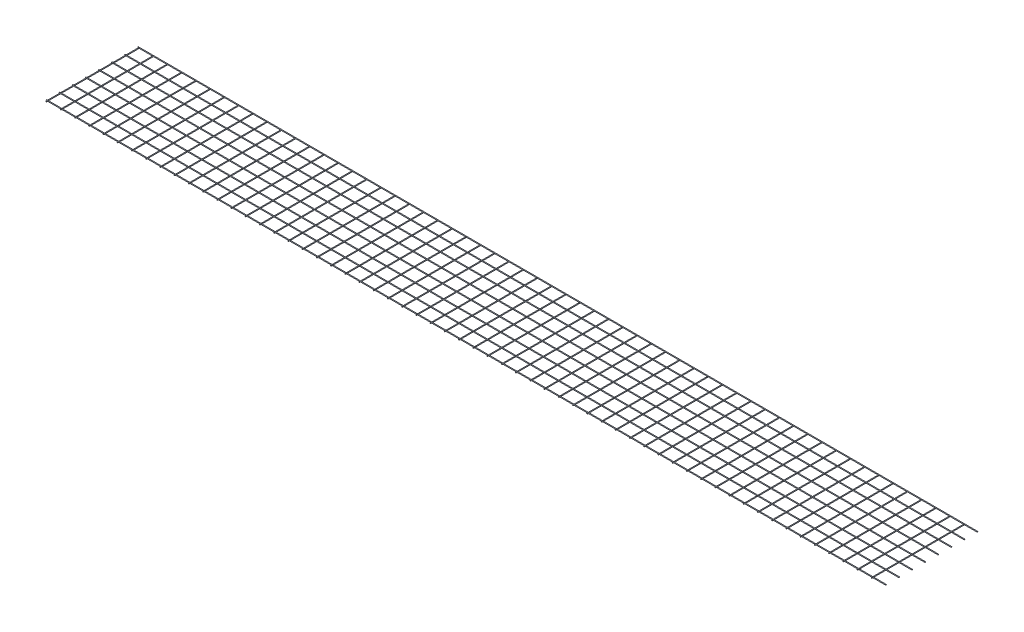
from build123d import *

# Parameters (mm, degrees)
SKETCH1_R              = 2.5
BOSS_EXTRUDE1_DEPTH    = 650
BOSS_EXTRUDE1_2_DEPTH  = 650
BOSS_EXTRUDE1_3_DEPTH  = 650
BOSS_EXTRUDE1_4_DEPTH  = 650
BOSS_EXTRUDE1_5_DEPTH  = 650
BOSS_EXTRUDE1_6_DEPTH  = 650
BOSS_EXTRUDE1_7_DEPTH  = 650
BOSS_EXTRUDE1_8_DEPTH  = 650
BOSS_EXTRUDE1_9_DEPTH  = 650
BOSS_EXTRUDE1_10_DEPTH = 650
BOSS_EXTRUDE1_11_DEPTH = 650
BOSS_EXTRUDE1_12_DEPTH = 650
BOSS_EXTRUDE1_13_DEPTH = 650
BOSS_EXTRUDE1_14_DEPTH = 650
BOSS_EXTRUDE1_15_DEPTH = 650
BOSS_EXTRUDE1_16_DEPTH = 650
BOSS_EXTRUDE1_17_DEPTH = 650
BOSS_EXTRUDE1_18_DEPTH = 650
BOSS_EXTRUDE1_19_DEPTH = 650
BOSS_EXTRUDE1_20_DEPTH = 650
BOSS_EXTRUDE1_21_DEPTH = 650
BOSS_EXTRUDE1_22_DEPTH = 650
BOSS_EXTRUDE1_23_DEPTH = 650
BOSS_EXTRUDE1_24_DEPTH = 650
BOSS_EXTRUDE1_25_DEPTH = 650
BOSS_EXTRUDE1_26_DEPTH = 650
BOSS_EXTRUDE1_27_DEPTH = 650
BOSS_EXTRUDE1_28_DEPTH = 650
BOSS_EXTRUDE1_29_DEPTH = 650
BOSS_EXTRUDE1_30_DEPTH = 650
BOSS_EXTRUDE1_31_DEPTH = 650
BOSS_EXTRUDE1_32_DEPTH = 650
BOSS_EXTRUDE1_33_DEPTH = 650
BOSS_EXTRUDE1_34_DEPTH = 650
BOSS_EXTRUDE1_35_DEPTH = 650
BOSS_EXTRUDE1_36_DEPTH = 650
BOSS_EXTRUDE1_37_DEPTH = 650
BOSS_EXTRUDE1_38_DEPTH = 650
BOSS_EXTRUDE1_39_DEPTH = 650
BOSS_EXTRUDE1_40_DEPTH = 650
BOSS_EXTRUDE1_41_DEPTH = 650
BOSS_EXTRUDE1_42_DEPTH = 650
BOSS_EXTRUDE1_43_DEPTH = 650
BOSS_EXTRUDE1_44_DEPTH = 650
BOSS_EXTRUDE1_45_DEPTH = 650
BOSS_EXTRUDE1_46_DEPTH = 650
BOSS_EXTRUDE1_47_DEPTH = 650
BOSS_EXTRUDE1_48_DEPTH = 650
BOSS_EXTRUDE1_49_DEPTH = 650
BOSS_EXTRUDE1_50_DEPTH = 650
BOSS_EXTRUDE1_51_DEPTH = 650
BOSS_EXTRUDE1_52_DEPTH = 650
BOSS_EXTRUDE1_53_DEPTH = 650
BOSS_EXTRUDE1_54_DEPTH = 650
BOSS_EXTRUDE1_55_DEPTH = 650
BOSS_EXTRUDE1_56_DEPTH = 650
BOSS_EXTRUDE1_57_DEPTH = 650
BOSS_EXTRUDE1_58_DEPTH = 650
BOSS_EXTRUDE1_59_DEPTH = 650
SKETCH2_R              = 2.5
BOSS_EXTRUDE2_DEPTH    = 5900
BOSS_EXTRUDE2_2_DEPTH  = 5900
BOSS_EXTRUDE2_3_DEPTH  = 5900
BOSS_EXTRUDE2_4_DEPTH  = 5900
BOSS_EXTRUDE2_5_DEPTH  = 5900
BOSS_EXTRUDE2_6_DEPTH  = 5900
BOSS_EXTRUDE2_7_DEPTH  = 5900
BOSS_EXTRUDE2_8_DEPTH  = 5900


with BuildPart() as part:
    # Sketch1 → Boss-Extrude1 (new body)
    with BuildSketch(Plane.XY):
        with Locations((-80.079456232, 0)):
            Circle(SKETCH1_R)
    extrude(amount=BOSS_EXTRUDE1_DEPTH)


with BuildPart() as body_2:
    # Sketch1 → Boss-Extrude1 2 (new body)
    with BuildSketch(Plane.XY):
        with Locations((19.920543768, 0)):
            Circle(SKETCH1_R)
    extrude(amount=BOSS_EXTRUDE1_2_DEPTH)


with BuildPart() as body_3:
    # Sketch1 → Boss-Extrude1 3 (new body)
    with BuildSketch(Plane.XY):
        with Locations((119.920543768, 0)):
            Circle(SKETCH1_R)
    extrude(amount=BOSS_EXTRUDE1_3_DEPTH)


with BuildPart() as body_4:
    # Sketch1 → Boss-Extrude1 4 (new body)
    with BuildSketch(Plane.XY):
        with Locations((219.920543768, 0)):
            Circle(SKETCH1_R)
    extrude(amount=BOSS_EXTRUDE1_4_DEPTH)


with BuildPart() as body_5:
    # Sketch1 → Boss-Extrude1 5 (new body)
    with BuildSketch(Plane.XY):
        with Locations((319.920543768, 0)):
            Circle(SKETCH1_R)
    extrude(amount=BOSS_EXTRUDE1_5_DEPTH)


with BuildPart() as body_6:
    # Sketch1 → Boss-Extrude1 6 (new body)
    with BuildSketch(Plane.XY):
        with Locations((419.920543768, 0)):
            Circle(SKETCH1_R)
    extrude(amount=BOSS_EXTRUDE1_6_DEPTH)


with BuildPart() as body_7:
    # Sketch1 → Boss-Extrude1 7 (new body)
    with BuildSketch(Plane.XY):
        with Locations((519.920543768, 0)):
            Circle(SKETCH1_R)
    extrude(amount=BOSS_EXTRUDE1_7_DEPTH)


with BuildPart() as body_8:
    # Sketch1 → Boss-Extrude1 8 (new body)
    with BuildSketch(Plane.XY):
        with Locations((619.920543768, 0)):
            Circle(SKETCH1_R)
    extrude(amount=BOSS_EXTRUDE1_8_DEPTH)


with BuildPart() as body_9:
    # Sketch1 → Boss-Extrude1 9 (new body)
    with BuildSketch(Plane.XY):
        with Locations((719.920543768, 0)):
            Circle(SKETCH1_R)
    extrude(amount=BOSS_EXTRUDE1_9_DEPTH)


with BuildPart() as body_10:
    # Sketch1 → Boss-Extrude1 10 (new body)
    with BuildSketch(Plane.XY):
        with Locations((819.920543768, 0)):
            Circle(SKETCH1_R)
    extrude(amount=BOSS_EXTRUDE1_10_DEPTH)


with BuildPart() as body_11:
    # Sketch1 → Boss-Extrude1 11 (new body)
    with BuildSketch(Plane.XY):
        with Locations((919.920543768, 0)):
            Circle(SKETCH1_R)
    extrude(amount=BOSS_EXTRUDE1_11_DEPTH)


with BuildPart() as body_12:
    # Sketch1 → Boss-Extrude1 12 (new body)
    with BuildSketch(Plane.XY):
        with Locations((1019.920543768, 0)):
            Circle(SKETCH1_R)
    extrude(amount=BOSS_EXTRUDE1_12_DEPTH)


with BuildPart() as body_13:
    # Sketch1 → Boss-Extrude1 13 (new body)
    with BuildSketch(Plane.XY):
        with Locations((1119.920543768, 0)):
            Circle(SKETCH1_R)
    extrude(amount=BOSS_EXTRUDE1_13_DEPTH)


with BuildPart() as body_14:
    # Sketch1 → Boss-Extrude1 14 (new body)
    with BuildSketch(Plane.XY):
        with Locations((1219.920543768, 0)):
            Circle(SKETCH1_R)
    extrude(amount=BOSS_EXTRUDE1_14_DEPTH)


with BuildPart() as body_15:
    # Sketch1 → Boss-Extrude1 15 (new body)
    with BuildSketch(Plane.XY):
        with Locations((1319.920543768, 0)):
            Circle(SKETCH1_R)
    extrude(amount=BOSS_EXTRUDE1_15_DEPTH)


with BuildPart() as body_16:
    # Sketch1 → Boss-Extrude1 16 (new body)
    with BuildSketch(Plane.XY):
        with Locations((1419.920543768, 0)):
            Circle(SKETCH1_R)
    extrude(amount=BOSS_EXTRUDE1_16_DEPTH)


with BuildPart() as body_17:
    # Sketch1 → Boss-Extrude1 17 (new body)
    with BuildSketch(Plane.XY):
        with Locations((1519.920543768, 0)):
            Circle(SKETCH1_R)
    extrude(amount=BOSS_EXTRUDE1_17_DEPTH)


with BuildPart() as body_18:
    # Sketch1 → Boss-Extrude1 18 (new body)
    with BuildSketch(Plane.XY):
        with Locations((1619.920543768, 0)):
            Circle(SKETCH1_R)
    extrude(amount=BOSS_EXTRUDE1_18_DEPTH)


with BuildPart() as body_19:
    # Sketch1 → Boss-Extrude1 19 (new body)
    with BuildSketch(Plane.XY):
        with Locations((1719.920543768, 0)):
            Circle(SKETCH1_R)
    extrude(amount=BOSS_EXTRUDE1_19_DEPTH)


with BuildPart() as body_20:
    # Sketch1 → Boss-Extrude1 20 (new body)
    with BuildSketch(Plane.XY):
        with Locations((1819.920543768, 0)):
            Circle(SKETCH1_R)
    extrude(amount=BOSS_EXTRUDE1_20_DEPTH)


with BuildPart() as body_21:
    # Sketch1 → Boss-Extrude1 21 (new body)
    with BuildSketch(Plane.XY):
        with Locations((1919.920543768, 0)):
            Circle(SKETCH1_R)
    extrude(amount=BOSS_EXTRUDE1_21_DEPTH)


with BuildPart() as body_22:
    # Sketch1 → Boss-Extrude1 22 (new body)
    with BuildSketch(Plane.XY):
        with Locations((2019.920543768, 0)):
            Circle(SKETCH1_R)
    extrude(amount=BOSS_EXTRUDE1_22_DEPTH)


with BuildPart() as body_23:
    # Sketch1 → Boss-Extrude1 23 (new body)
    with BuildSketch(Plane.XY):
        with Locations((2119.920543768, 0)):
            Circle(SKETCH1_R)
    extrude(amount=BOSS_EXTRUDE1_23_DEPTH)


with BuildPart() as body_24:
    # Sketch1 → Boss-Extrude1 24 (new body)
    with BuildSketch(Plane.XY):
        with Locations((2219.920543768, 0)):
            Circle(SKETCH1_R)
    extrude(amount=BOSS_EXTRUDE1_24_DEPTH)


with BuildPart() as body_25:
    # Sketch1 → Boss-Extrude1 25 (new body)
    with BuildSketch(Plane.XY):
        with Locations((2319.920543768, 0)):
            Circle(SKETCH1_R)
    extrude(amount=BOSS_EXTRUDE1_25_DEPTH)


with BuildPart() as body_26:
    # Sketch1 → Boss-Extrude1 26 (new body)
    with BuildSketch(Plane.XY):
        with Locations((2419.920543768, 0)):
            Circle(SKETCH1_R)
    extrude(amount=BOSS_EXTRUDE1_26_DEPTH)


with BuildPart() as body_27:
    # Sketch1 → Boss-Extrude1 27 (new body)
    with BuildSketch(Plane.XY):
        with Locations((2519.920543768, 0)):
            Circle(SKETCH1_R)
    extrude(amount=BOSS_EXTRUDE1_27_DEPTH)


with BuildPart() as body_28:
    # Sketch1 → Boss-Extrude1 28 (new body)
    with BuildSketch(Plane.XY):
        with Locations((2619.920543768, 0)):
            Circle(SKETCH1_R)
    extrude(amount=BOSS_EXTRUDE1_28_DEPTH)


with BuildPart() as body_29:
    # Sketch1 → Boss-Extrude1 29 (new body)
    with BuildSketch(Plane.XY):
        with Locations((2719.920543768, 0)):
            Circle(SKETCH1_R)
    extrude(amount=BOSS_EXTRUDE1_29_DEPTH)


with BuildPart() as body_30:
    # Sketch1 → Boss-Extrude1 30 (new body)
    with BuildSketch(Plane.XY):
        with Locations((2819.920543768, 0)):
            Circle(SKETCH1_R)
    extrude(amount=BOSS_EXTRUDE1_30_DEPTH)


with BuildPart() as body_31:
    # Sketch1 → Boss-Extrude1 31 (new body)
    with BuildSketch(Plane.XY):
        with Locations((2919.920543768, 0)):
            Circle(SKETCH1_R)
    extrude(amount=BOSS_EXTRUDE1_31_DEPTH)


with BuildPart() as body_32:
    # Sketch1 → Boss-Extrude1 32 (new body)
    with BuildSketch(Plane.XY):
        with Locations((3019.920543768, 0)):
            Circle(SKETCH1_R)
    extrude(amount=BOSS_EXTRUDE1_32_DEPTH)


with BuildPart() as body_33:
    # Sketch1 → Boss-Extrude1 33 (new body)
    with BuildSketch(Plane.XY):
        with Locations((3119.920543768, 0)):
            Circle(SKETCH1_R)
    extrude(amount=BOSS_EXTRUDE1_33_DEPTH)


with BuildPart() as body_34:
    # Sketch1 → Boss-Extrude1 34 (new body)
    with BuildSketch(Plane.XY):
        with Locations((3219.920543768, 0)):
            Circle(SKETCH1_R)
    extrude(amount=BOSS_EXTRUDE1_34_DEPTH)


with BuildPart() as body_35:
    # Sketch1 → Boss-Extrude1 35 (new body)
    with BuildSketch(Plane.XY):
        with Locations((3319.920543768, 0)):
            Circle(SKETCH1_R)
    extrude(amount=BOSS_EXTRUDE1_35_DEPTH)


with BuildPart() as body_36:
    # Sketch1 → Boss-Extrude1 36 (new body)
    with BuildSketch(Plane.XY):
        with Locations((3419.920543768, 0)):
            Circle(SKETCH1_R)
    extrude(amount=BOSS_EXTRUDE1_36_DEPTH)


with BuildPart() as body_37:
    # Sketch1 → Boss-Extrude1 37 (new body)
    with BuildSketch(Plane.XY):
        with Locations((3519.920543768, 0)):
            Circle(SKETCH1_R)
    extrude(amount=BOSS_EXTRUDE1_37_DEPTH)


with BuildPart() as body_38:
    # Sketch1 → Boss-Extrude1 38 (new body)
    with BuildSketch(Plane.XY):
        with Locations((3619.920543768, 0)):
            Circle(SKETCH1_R)
    extrude(amount=BOSS_EXTRUDE1_38_DEPTH)


with BuildPart() as body_39:
    # Sketch1 → Boss-Extrude1 39 (new body)
    with BuildSketch(Plane.XY):
        with Locations((3719.920543768, 0)):
            Circle(SKETCH1_R)
    extrude(amount=BOSS_EXTRUDE1_39_DEPTH)


with BuildPart() as body_40:
    # Sketch1 → Boss-Extrude1 40 (new body)
    with BuildSketch(Plane.XY):
        with Locations((3819.920543768, 0)):
            Circle(SKETCH1_R)
    extrude(amount=BOSS_EXTRUDE1_40_DEPTH)


with BuildPart() as body_41:
    # Sketch1 → Boss-Extrude1 41 (new body)
    with BuildSketch(Plane.XY):
        with Locations((3919.920543768, 0)):
            Circle(SKETCH1_R)
    extrude(amount=BOSS_EXTRUDE1_41_DEPTH)


with BuildPart() as body_42:
    # Sketch1 → Boss-Extrude1 42 (new body)
    with BuildSketch(Plane.XY):
        with Locations((4019.920543768, 0)):
            Circle(SKETCH1_R)
    extrude(amount=BOSS_EXTRUDE1_42_DEPTH)


with BuildPart() as body_43:
    # Sketch1 → Boss-Extrude1 43 (new body)
    with BuildSketch(Plane.XY):
        with Locations((4119.920543768, 0)):
            Circle(SKETCH1_R)
    extrude(amount=BOSS_EXTRUDE1_43_DEPTH)


with BuildPart() as body_44:
    # Sketch1 → Boss-Extrude1 44 (new body)
    with BuildSketch(Plane.XY):
        with Locations((4219.920543768, 0)):
            Circle(SKETCH1_R)
    extrude(amount=BOSS_EXTRUDE1_44_DEPTH)


with BuildPart() as body_45:
    # Sketch1 → Boss-Extrude1 45 (new body)
    with BuildSketch(Plane.XY):
        with Locations((4319.920543768, 0)):
            Circle(SKETCH1_R)
    extrude(amount=BOSS_EXTRUDE1_45_DEPTH)


with BuildPart() as body_46:
    # Sketch1 → Boss-Extrude1 46 (new body)
    with BuildSketch(Plane.XY):
        with Locations((4419.920543768, 0)):
            Circle(SKETCH1_R)
    extrude(amount=BOSS_EXTRUDE1_46_DEPTH)


with BuildPart() as body_47:
    # Sketch1 → Boss-Extrude1 47 (new body)
    with BuildSketch(Plane.XY):
        with Locations((4519.920543768, 0)):
            Circle(SKETCH1_R)
    extrude(amount=BOSS_EXTRUDE1_47_DEPTH)


with BuildPart() as body_48:
    # Sketch1 → Boss-Extrude1 48 (new body)
    with BuildSketch(Plane.XY):
        with Locations((4619.920543768, 0)):
            Circle(SKETCH1_R)
    extrude(amount=BOSS_EXTRUDE1_48_DEPTH)


with BuildPart() as body_49:
    # Sketch1 → Boss-Extrude1 49 (new body)
    with BuildSketch(Plane.XY):
        with Locations((4719.920543768, 0)):
            Circle(SKETCH1_R)
    extrude(amount=BOSS_EXTRUDE1_49_DEPTH)


with BuildPart() as body_50:
    # Sketch1 → Boss-Extrude1 50 (new body)
    with BuildSketch(Plane.XY):
        with Locations((4819.920543768, 0)):
            Circle(SKETCH1_R)
    extrude(amount=BOSS_EXTRUDE1_50_DEPTH)


with BuildPart() as body_51:
    # Sketch1 → Boss-Extrude1 51 (new body)
    with BuildSketch(Plane.XY):
        with Locations((4919.920543768, 0)):
            Circle(SKETCH1_R)
    extrude(amount=BOSS_EXTRUDE1_51_DEPTH)


with BuildPart() as body_52:
    # Sketch1 → Boss-Extrude1 52 (new body)
    with BuildSketch(Plane.XY):
        with Locations((5019.920543768, 0)):
            Circle(SKETCH1_R)
    extrude(amount=BOSS_EXTRUDE1_52_DEPTH)


with BuildPart() as body_53:
    # Sketch1 → Boss-Extrude1 53 (new body)
    with BuildSketch(Plane.XY):
        with Locations((5119.920543768, 0)):
            Circle(SKETCH1_R)
    extrude(amount=BOSS_EXTRUDE1_53_DEPTH)


with BuildPart() as body_54:
    # Sketch1 → Boss-Extrude1 54 (new body)
    with BuildSketch(Plane.XY):
        with Locations((5219.920543768, 0)):
            Circle(SKETCH1_R)
    extrude(amount=BOSS_EXTRUDE1_54_DEPTH)


with BuildPart() as body_55:
    # Sketch1 → Boss-Extrude1 55 (new body)
    with BuildSketch(Plane.XY):
        with Locations((5319.920543768, 0)):
            Circle(SKETCH1_R)
    extrude(amount=BOSS_EXTRUDE1_55_DEPTH)


with BuildPart() as body_56:
    # Sketch1 → Boss-Extrude1 56 (new body)
    with BuildSketch(Plane.XY):
        with Locations((5419.920543768, 0)):
            Circle(SKETCH1_R)
    extrude(amount=BOSS_EXTRUDE1_56_DEPTH)


with BuildPart() as body_57:
    # Sketch1 → Boss-Extrude1 57 (new body)
    with BuildSketch(Plane.XY):
        with Locations((5519.920543768, 0)):
            Circle(SKETCH1_R)
    extrude(amount=BOSS_EXTRUDE1_57_DEPTH)


with BuildPart() as body_58:
    # Sketch1 → Boss-Extrude1 58 (new body)
    with BuildSketch(Plane.XY):
        with Locations((5619.920543768, 0)):
            Circle(SKETCH1_R)
    extrude(amount=BOSS_EXTRUDE1_58_DEPTH)


with BuildPart() as body_59:
    # Sketch1 → Boss-Extrude1 59 (new body)
    with BuildSketch(Plane.XY):
        with Locations((5719.920543768, 0)):
            Circle(SKETCH1_R)
    extrude(amount=BOSS_EXTRUDE1_59_DEPTH)


with BuildPart() as body_60:
    # Sketch2 → Boss-Extrude2 (new body)
    with BuildSketch(Plane.ZY.offset(82.579456232)):
        with Locations((2.5, 5)):
            Circle(SKETCH2_R)
    extrude(amount=-BOSS_EXTRUDE2_DEPTH)


with BuildPart() as body_61:
    # Sketch2 → Boss-Extrude2 2 (new body)
    with BuildSketch(Plane.ZY.offset(82.579456232)):
        with Locations((94.5, 5)):
            Circle(SKETCH2_R)
    extrude(amount=-BOSS_EXTRUDE2_2_DEPTH)


with BuildPart() as body_62:
    # Sketch2 → Boss-Extrude2 3 (new body)
    with BuildSketch(Plane.ZY.offset(82.579456232)):
        with Locations((186.5, 5)):
            Circle(SKETCH2_R)
    extrude(amount=-BOSS_EXTRUDE2_3_DEPTH)


with BuildPart() as body_63:
    # Sketch2 → Boss-Extrude2 4 (new body)
    with BuildSketch(Plane.ZY.offset(82.579456232)):
        with Locations((278.5, 5)):
            Circle(SKETCH2_R)
    extrude(amount=-BOSS_EXTRUDE2_4_DEPTH)


with BuildPart() as body_64:
    # Sketch2 → Boss-Extrude2 5 (new body)
    with BuildSketch(Plane.ZY.offset(82.579456232)):
        with Locations((370.5, 5)):
            Circle(SKETCH2_R)
    extrude(amount=-BOSS_EXTRUDE2_5_DEPTH)


with BuildPart() as body_65:
    # Sketch2 → Boss-Extrude2 6 (new body)
    with BuildSketch(Plane.ZY.offset(82.579456232)):
        with Locations((462.5, 5)):
            Circle(SKETCH2_R)
    extrude(amount=-BOSS_EXTRUDE2_6_DEPTH)


with BuildPart() as body_66:
    # Sketch2 → Boss-Extrude2 7 (new body)
    with BuildSketch(Plane.ZY.offset(82.579456232)):
        with Locations((554.5, 5)):
            Circle(SKETCH2_R)
    extrude(amount=-BOSS_EXTRUDE2_7_DEPTH)


with BuildPart() as body_67:
    # Sketch2 → Boss-Extrude2 8 (new body)
    with BuildSketch(Plane.ZY.offset(82.579456232)):
        with Locations((646.5, 5)):
            Circle(SKETCH2_R)
    extrude(amount=-BOSS_EXTRUDE2_8_DEPTH)


solid = Compound([part.part, body_2.part, body_3.part, body_4.part, body_5.part, body_6.part, body_7.part, body_8.part, body_9.part, body_10.part, body_11.part, body_12.part, body_13.part, body_14.part, body_15.part, body_16.part, body_17.part, body_18.part, body_19.part, body_20.part, body_21.part, body_22.part, body_23.part, body_24.part, body_25.part, body_26.part, body_27.part, body_28.part, body_29.part, body_30.part, body_31.part, body_32.part, body_33.part, body_34.part, body_35.part, body_36.part, body_37.part, body_38.part, body_39.part, body_40.part, body_41.part, body_42.part, body_43.part, body_44.part, body_45.part, body_46.part, body_47.part, body_48.part, body_49.part, body_50.part, body_51.part, body_52.part, body_53.part, body_54.part, body_55.part, body_56.part, body_57.part, body_58.part, body_59.part, body_60.part, body_61.part, body_62.part, body_63.part, body_64.part, body_65.part, body_66.part, body_67.part])
